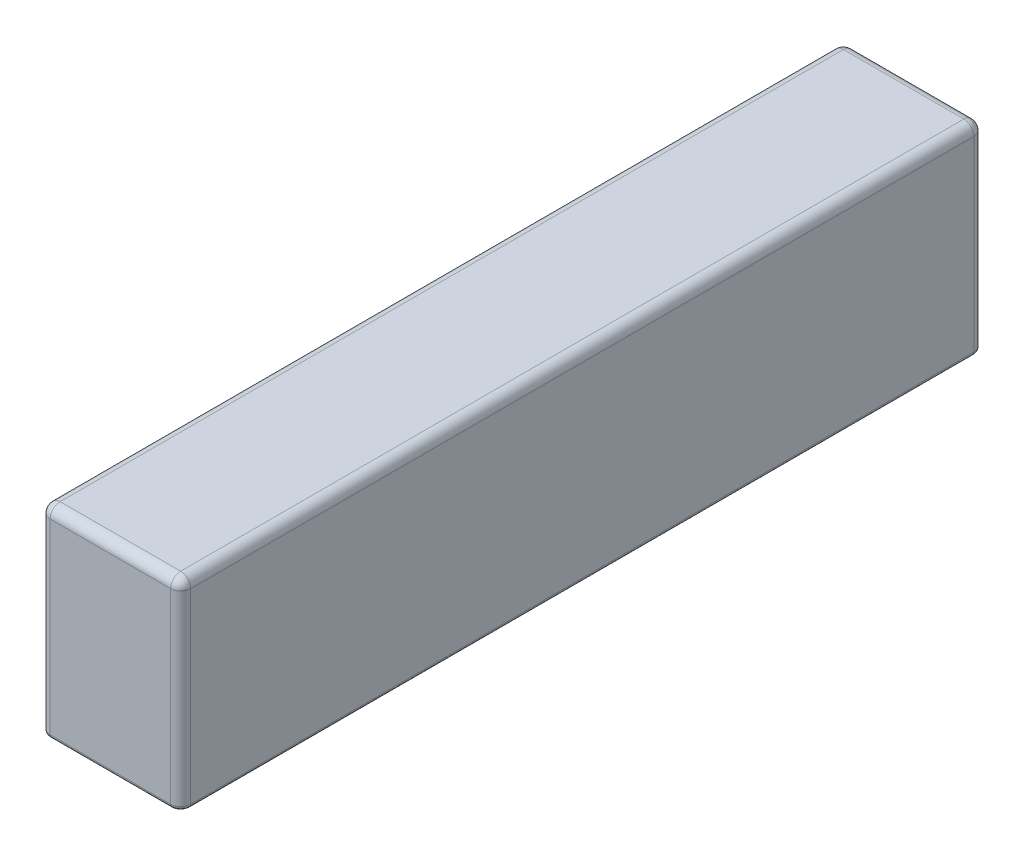
from build123d import *

# Parameters (mm, degrees)
SKETCH1_W           = 7
SKETCH1_H           = 40
BOSS_EXTRUDE1_DEPTH = 5
FILLET1_R           = 0.5
FILLET2_R           = 0.2


with BuildPart() as part:
    # Sketch1 → Boss-Extrude1 (new, symmetric)
    with BuildSketch(Plane(origin=(0, 0, 0), x_dir=(1, 0, 0), z_dir=(0, 1, 0))):
        Rectangle(SKETCH1_W, SKETCH1_H)
    extrude(amount=BOSS_EXTRUDE1_DEPTH, both=True)

    # Fillet1
    fillet1_edges = [part.edges().sort_by_distance(p)[0] for p in [
        (-3.5, 5, 0),
        (0, 5, 20),
        (3.5, 5, 0),
        (3.5, 0, 20),
        (-3.5, 0, 20),
        (-3.5, 0, -20),
        (3.5, 0, -20),
        (0, 5, -20),
    ]]
    fillet(fillet1_edges, radius=FILLET1_R)

    # Fillet2
    fillet2_edges = [part.edges().sort_by_distance(p)[0] for p in [
        (0, -5, -20),
        (3.5, -5, 0),
        (0, -5, 20),
        (-3.5, -5, 0),
        (-3.353553391, -5, -19.853553391),
        (-3.353553391, -5, 19.853553391),
        (3.353553391, -5, 19.853553391),
        (3.353553391, -5, -19.853553391),
    ]]
    fillet(fillet2_edges, radius=FILLET2_R)


solid = part.part
